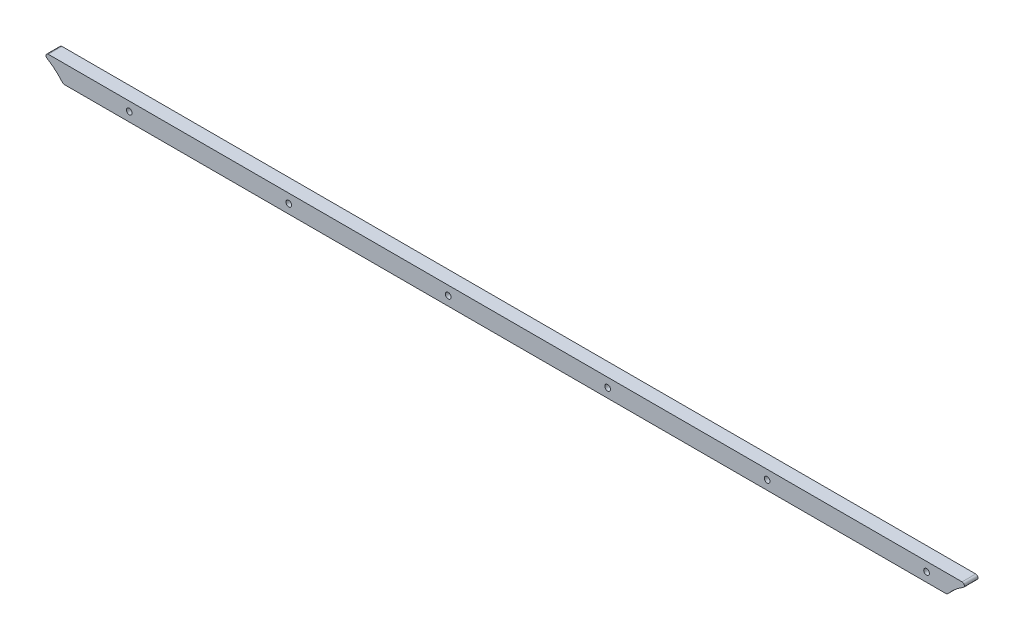
from build123d import *

# Parameters (mm, degrees)
AUFSATZ_LINEAR_START             = -2.5
AUFSATZ_LINEAR_AUSTRAGEN1_DEPTH  = 6
VERRUNDUNG1_R                    = 1
F_2_5_2_5_DURCHMESSER_BOHRUNG1_D = 2.5


with BuildPart() as part:
    # Skizze1 → Aufsatz-Linear austragen1 (new body)
    with BuildSketch(Plane.XY.offset(AUFSATZ_LINEAR_START)):
        with BuildLine():
            Line((225, 17), (409.023823037, 17))
            ThreePointArc((409.023823037, 17), (413.907829989, 21.680453509), (419.801960973, 25))
            Line((419.801960973, 25), (10.198039027, 25))
            ThreePointArc((10.198039027, 25), (16.092170011, 21.680453509), (20.976176963, 17))
            Line((20.976176963, 17), (225, 17))
        make_face()
    extrude(amount=-AUFSATZ_LINEAR_AUSTRAGEN1_DEPTH)

    # Verrundung1
    verrundung1_edges = [part.edges().sort_by_distance(p)[0] for p in [
        (409.023823037, 17, -5.5),
        (20.976176963, 17, -5.5),
        (10.198039027, 25, -5.5),
        (419.801960973, 25, -5.5),
    ]]
    fillet(verrundung1_edges, radius=VERRUNDUNG1_R)

    # Ø2.5 (2.5) Durchmesser Bohrung1 (through all)
    with Locations(Plane.XY.offset(-2.5)):
        with Locations((400, 21), (330, 21), (260, 21), (190, 21), (120, 21), (50, 21)):
            Hole(F_2_5_2_5_DURCHMESSER_BOHRUNG1_D / 2)


solid = part.part
